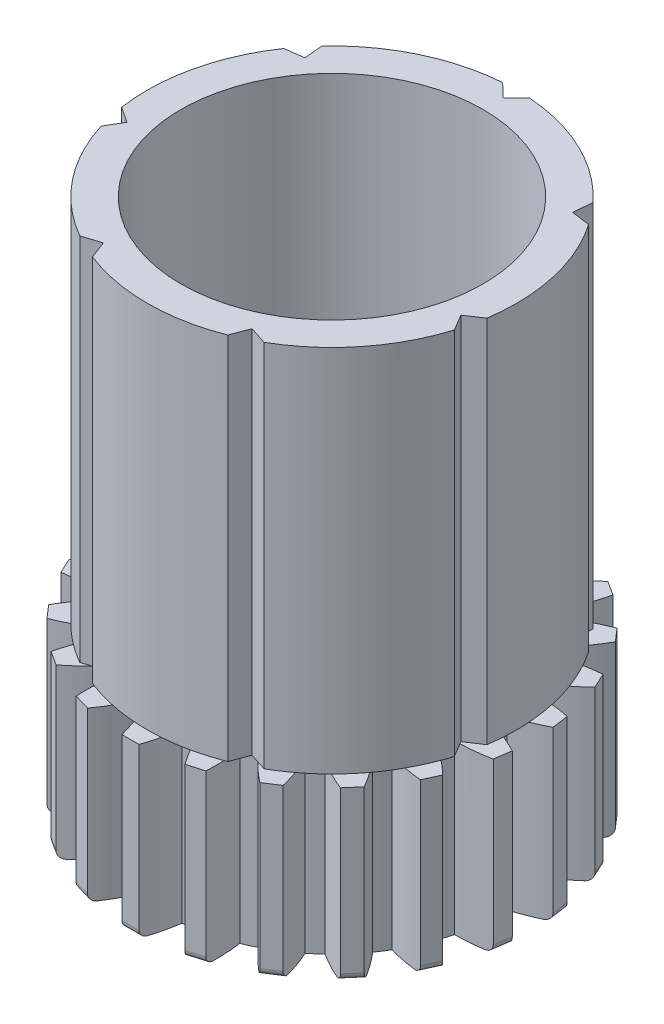
from build123d import *

# Parameters (mm, degrees)
SKETCH_1_R                       = 5
EXTRUDE_1_DEPTH                  = 5
EXTRUDE_2_DEPTH                  = 5
FILLET_1_R                       = 0.2
PATTERN_CIRCULAR_2_COUNT         = 22
FILLET_1_OF_PATTERN_CIRCULAR_2_R = 0.2
SKETCH_3_R                       = 5.5
EXTRUDE_3_DEPTH                  = 11
CUT_EXTRUDE_START                = -11
CUT_EXTRUDE_1_DEPTH              = 11
PATTERN_CIRCULAR_3_COUNT         = 7


with BuildPart() as part:
    # 草图1 → 凸台-拉伸1 (new body)
    with BuildSketch(Plane(origin=(0, 0, 0), x_dir=(1, 0, 0), z_dir=(0, 1, 0))):
        with Locations(Location((0, 0, 0), (0, 0, 270))):
            Circle(SKETCH_1_R)
    extrude(amount=EXTRUDE_1_DEPTH)

    # 草图2 → 凸台-拉伸2 (add)
    with BuildSketch(Plane.XZ):
        with BuildLine():
            Line((0.25, 6), (-0.25, 6))
            ThreePointArc((-0.25, 6), (-0.401638318, 5.493398356), (-0.503808814, 4.974552912))
            ThreePointArc((-0.503808814, 4.974552912), (0, 5), (0.503808814, 4.974552912))
            ThreePointArc((0.503808814, 4.974552912), (0.401638318, 5.493398356), (0.25, 6))
        make_face()
    extrude_2 = extrude(amount=-EXTRUDE_2_DEPTH)

    # 圆角1
    fillet_1_edges = [part.edges().sort_by_distance(p)[0] for p in [
        (0, 0, 6),
    ]]
    fillet(fillet_1_edges, radius=FILLET_1_R)

    # 阵列(圆周)2: 凸台-拉伸2 ×22 about axis
    pattern_circular_2_axis = Axis((0, 0, 0), (0, 1, 0))
    for i in range(1, PATTERN_CIRCULAR_2_COUNT):
        add(extrude_2.rotate(pattern_circular_2_axis, i * 360 / PATTERN_CIRCULAR_2_COUNT))

    # 圆角1 of 阵列(圆周)2
    fillet_1_of_pattern_circular_2_edges = [part.edges().sort_by_distance(p)[0] for p in [
        (1.690395341, 0, 5.756957842),
        (3.243844905, 0, 5.047521197),
        (4.534497446, 0, 3.929164404),
        (5.457791972, 0, 2.492490078),
        (5.938928651, 0, 0.85388903),
        (5.938928651, 0, -0.85388903),
        (5.457791972, 0, -2.492490078),
        (4.534497446, 0, -3.929164404),
        (3.243844905, 0, -5.047521197),
        (1.690395341, 0, -5.756957842),
        (0, 0, -6),
        (-1.690395341, 0, -5.756957842),
        (-3.243844905, 0, -5.047521197),
        (-4.534497446, 0, -3.929164404),
        (-5.457791972, 0, -2.492490078),
        (-5.938928651, 0, -0.85388903),
        (-5.938928651, 0, 0.85388903),
        (-5.457791972, 0, 2.492490078),
        (-4.534497446, 0, 3.929164404),
        (-3.243844905, 0, 5.047521197),
        (-1.690395341, 0, 5.756957842),
    ]]
    fillet(fillet_1_of_pattern_circular_2_edges, radius=FILLET_1_OF_PATTERN_CIRCULAR_2_R)

    # 草图3 → 凸台-拉伸3 (add)
    with BuildSketch(Plane(origin=(0, 5, 0), x_dir=(1, 0, 0), z_dir=(0, 1, 0))):
        with Locations(Location((0, 0, 0), (0, 0, 85.791027696))):
            Circle(SKETCH_3_R)
    extrude(amount=EXTRUDE_3_DEPTH)

    # 草图4 → 切除-旋转1 (revolve, cut)
    with BuildSketch(Plane(origin=(0, 0, 0), x_dir=(0, 0, -1), z_dir=(1, 0, 0))):
        Polygon((0, 16), (-4.5, 16), (-4.5, 9), (-3, 0), (0, 0), align=None)
    revolve(axis=Axis((0, 16, 0), (0, -1, 0)), mode=Mode.SUBTRACT)

    # 草图5 → 切除-拉伸1 (cut)
    with BuildSketch(Plane(origin=(0, 16, 0), x_dir=(1, 0, 0), z_dir=(0, 1, 0)).offset(CUT_EXTRUDE_START)):
        with BuildLine():
            Line((-0.403669046, 5.485166479), (0, 5.1))
            Line((0, 5.1), (0.403669046, 5.485166479))
            ThreePointArc((0.403669046, 5.485166479), (0, 5.5), (-0.403669046, 5.485166479))
        make_face()
    cut_extrude_1 = extrude(amount=CUT_EXTRUDE_1_DEPTH, mode=Mode.SUBTRACT)

    # 阵列(圆周)3: 切除-拉伸1 ×7 about axis
    pattern_circular_3_axis = Axis((0, 0, 0), (0, 1, 0))
    for i in range(1, PATTERN_CIRCULAR_3_COUNT):
        add(cut_extrude_1.rotate(pattern_circular_3_axis, i * 360 / PATTERN_CIRCULAR_3_COUNT), mode=Mode.SUBTRACT)


solid = part.part
